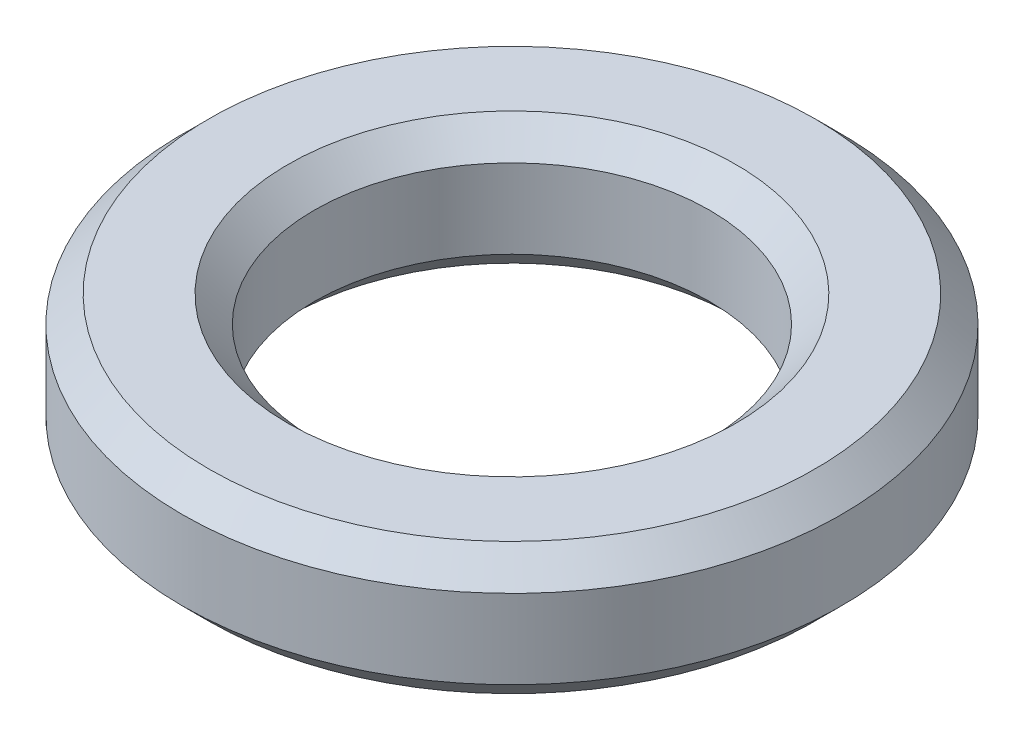
from build123d import *


with BuildPart() as part:
    # Sketch1 → Revolve1 (revolve)
    with BuildSketch(Plane.XY, mode=Mode.PRIVATE) as revolve1_sk:
        Polygon((7.5, 1.980769231), (8.5, 2.980769231), (11.5, 2.980769231), (12.5, 1.980769231), (12.5, -1.019230769), (11.5, -2.019230769), (8.5, -2.019230769), (7.5, -1.019230769), align=None)
    revolve(revolve1_sk.sketch.rotate(Axis((0, 24.006410256, 0), (0, -1, 0)), 90), axis=Axis((0, 24.006410256, 0), (0, -1, 0)))


solid = part.part
